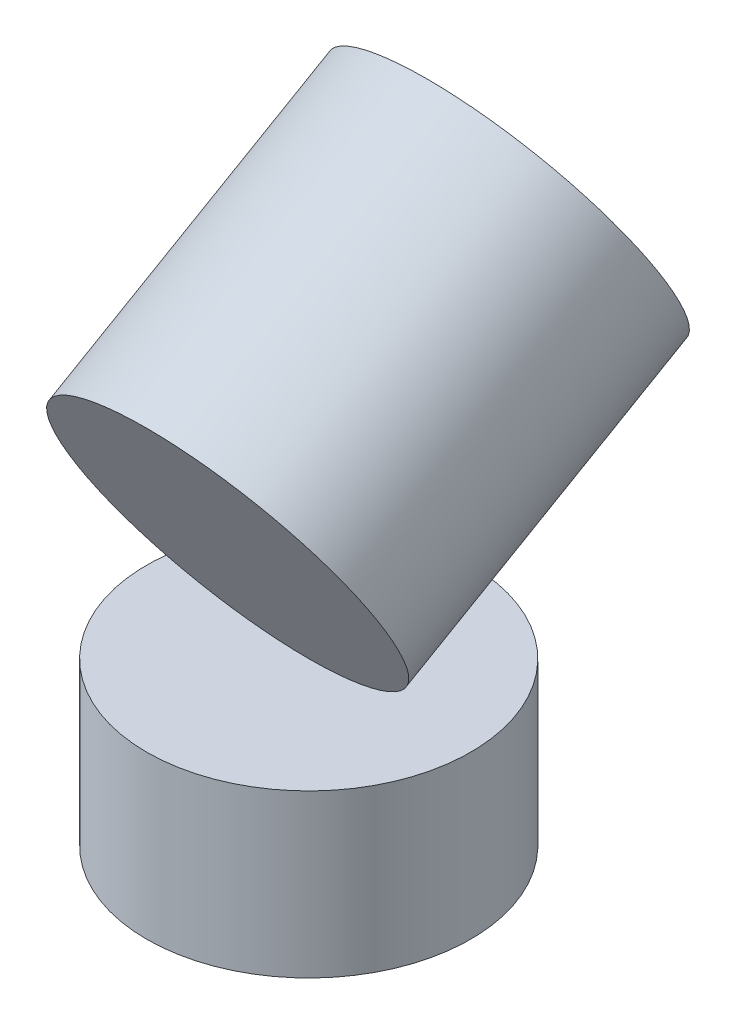
from build123d import *

# Parameters (mm, degrees)
SKETCH1_R           = 10
BOSS_EXTRUDE1_DEPTH = 10
SKETCH2_R           = 7.5
CUT_EXTRUDE1_DEPTH  = 5
SKETCH4_R           = 10
BOSS_EXTRUDE2_DEPTH = 20
SKETCH5_R           = 7.5
CUT_EXTRUDE2_DEPTH  = 10


with BuildPart() as part:
    # Sketch1 → Boss-Extrude1 (new body)
    with BuildSketch(Plane(origin=(0, 0, 0), x_dir=(1, 0, 0), z_dir=(0, 1, 0))):
        Circle(SKETCH1_R)
    extrude(amount=-BOSS_EXTRUDE1_DEPTH)

    # Sketch2 → Cut-Extrude1 (cut)
    with BuildSketch(Plane(origin=(0, -10, 0), x_dir=(-1, 0, 0), z_dir=(0, -1, 0))):
        Circle(SKETCH2_R)
    extrude(amount=-CUT_EXTRUDE1_DEPTH, mode=Mode.SUBTRACT)


with BuildPart() as body_2:
    # Sketch4 → Boss-Extrude2 (new body)
    with BuildSketch(Plane(origin=(0, 0, 0), x_dir=(1, 0, 0), z_dir=(0, -0.500000000000001, 0.866025403784438))):
        with Locations((0, 10)):
            Circle(SKETCH4_R)
    extrude(amount=-BOSS_EXTRUDE2_DEPTH)

    # Sketch5 → Cut-Extrude2 (cut)
    with BuildSketch(Plane(origin=(0, 10, -17.320508076), x_dir=(-1, 0, 0), z_dir=(0, 0.500000000000001, -0.8660254037844382))):
        with Locations((0, 10)):
            Circle(SKETCH5_R)
    extrude(amount=-CUT_EXTRUDE2_DEPTH, mode=Mode.SUBTRACT)


solid = Compound([part.part, body_2.part])
